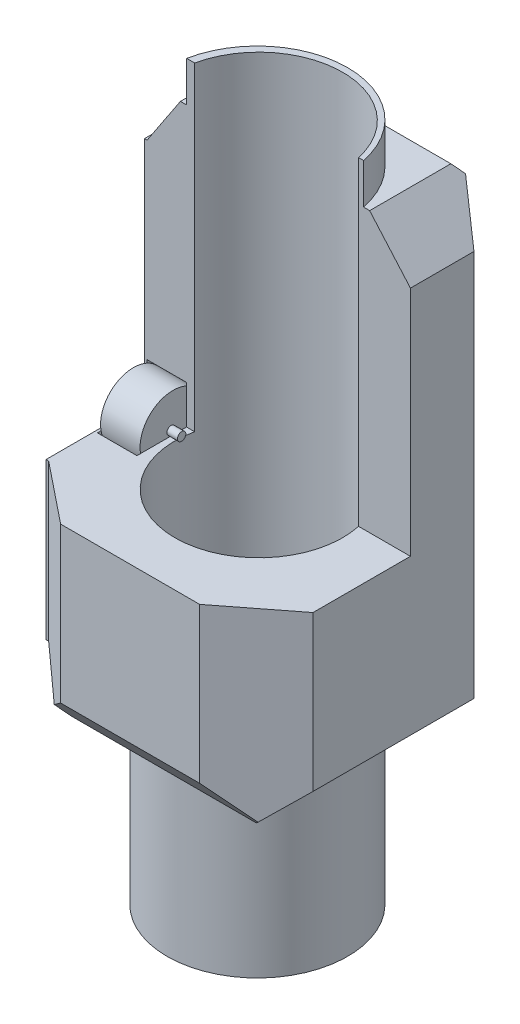
from build123d import *

# Parameters (mm, degrees)
SKETCH1_W           = 100
SKETCH1_H           = 100
BOSS_EXTRUDE1_DEPTH = 180
SKETCH2_R           = 34.257790197
BOSS_EXTRUDE2_DEPTH = 350
SKETCH3_W           = 152.006357392
SKETCH3_H           = 282.452416457
CUT_EXTRUDE2_DEPTH  = 400
CUT_EXTRUDE3_DEPTH  = 400
CUT_EXTRUDE4_DEPTH  = 400
CUT_EXTRUDE5_DEPTH  = 400
SKETCH7_W           = 160.159381639
SKETCH7_H           = 147.362276113
CUT_EXTRUDE6_DEPTH  = 400
SKETCH8_W           = 147.310744502
SKETCH8_H           = 162.038906966
CUT_EXTRUDE7_DEPTH  = 400
SKETCH9_R           = 31.847293423
CUT_EXTRUDE8_DEPTH  = 400
SKETCH10_W          = 140.220962397
SKETCH10_H          = 212.033531124
CUT_EXTRUDE9_DEPTH  = 400
SKETCH11_R          = 13.603137886
CUT_EXTRUDE11_DEPTH = 15
SKETCH12_R          = 12.495422516
BOSS_EXTRUDE3_DEPTH = 15
SKETCH13_R          = 1.594865099
BOSS_EXTRUDE4_DEPTH = 4
SKETCH14_W          = 100.74862993
SKETCH14_H          = 110.555003588
CUT_EXTRUDE13_DEPTH = 400
BOSS_EXTRUDE5_DEPTH = 1
SKETCH16_W          = 42.108585165
SKETCH16_H          = 30.458347221
BOSS_EXTRUDE6_DEPTH = 5
SKETCH17_W          = 18.669530869
SKETCH17_H          = 22.4027039
BOSS_EXTRUDE7_DEPTH = 1
SKETCH18_W          = 4.907623399
SKETCH18_H          = 5.170746831
SKETCH18_W_2        = 3.981473695
SKETCH18_H_2        = 5.451349552
BOSS_EXTRUDE8_DEPTH = 1
CUT_EXTRUDE14_DEPTH = 2


with BuildPart() as part:
    # Sketch1 → Boss-Extrude1 (new body)
    with BuildSketch(Plane(origin=(0, 0, 0), x_dir=(1, 0, 0), z_dir=(0, 1, 0))):
        with Locations((-50, 50)):
            Rectangle(SKETCH1_W, SKETCH1_H)
    extrude(amount=BOSS_EXTRUDE1_DEPTH)

    # Sketch2 → Boss-Extrude2 (add, symmetric)
    with BuildSketch(Plane(origin=(0, 180, 0), x_dir=(1, 0, 0), z_dir=(0, 1, 0))):
        with Locations(Location((-51.377291833, 49.076536384, 0), (0, 0, 270))):
            Circle(SKETCH2_R)
    extrude(amount=BOSS_EXTRUDE2_DEPTH, both=True)

    # Sketch3 → Cut-Extrude2 (cut)
    with BuildSketch(Plane(origin=(0, 0, 0), x_dir=(0, 0, -1), z_dir=(1, 0, 0))):
        with Locations((57.419900112, 502.274302507)):
            Rectangle(SKETCH3_W, SKETCH3_H)
    extrude(amount=-CUT_EXTRUDE2_DEPTH, mode=Mode.SUBTRACT)

    # Sketch4 → Cut-Extrude3 (cut)
    with BuildSketch(Plane(origin=(0, 0, 0), x_dir=(0, 0, -1), z_dir=(1, 0, 0))):
        Polygon((12.981970869, 0), (-8.994244796, 25.828096003), (-18.564506014, -15.259465835), align=None)
        Polygon((85.072517936, -1.448103984), (109.237639161, 19.113145112), (115.920034239, -3.267382694), align=None)
        Polygon((12.981970869, 180), (-8.994244796, 148.537596011), (-15.418178585, 193.219274892), align=None)
        Polygon((85.072517936, 181.854312784), (103.841225373, 159.795920888), (106.132549481, 198.647393934), align=None)
    extrude(amount=-CUT_EXTRUDE3_DEPTH, mode=Mode.SUBTRACT)

    # Sketch5 → Cut-Extrude4 (cut)
    with BuildSketch(Plane.XY):
        Polygon((-85.623287335, 0), (-106.370377984, 21.426392531), (-122.288861874, 3.209259887), (-93.526345261, -19.884701759), align=None)
        Polygon((-15.694988751, 0), (0, 15.257385304), (12.122677088, 15.257385304), (10.563067769, -19.884701759), align=None)
        Polygon((-87.166490339, 180.248071029), (-106.370377984, 151.29108453), (-117.705469457, 200.501115102), align=None)
        Polygon((-15.694988751, 180.248071029), (7.833767065, 153.279557508), (0, 193.941208308), align=None)
    extrude(amount=-CUT_EXTRUDE4_DEPTH, mode=Mode.SUBTRACT)

    # Sketch6 → Cut-Extrude5 (cut)
    with BuildSketch(Plane(origin=(0, 180, 0), x_dir=(1, 0, 0), z_dir=(0, 1, 0))):
        Polygon((-112.386997555, 28.400400964), (-64.261264503, -10.212759359), (-84.406366528, -15.51192827), (-124.649689542, -15.51192827), align=None)
        Polygon((-97.065537028, 135.861756084), (-119.37552445, 77.792688888), (-118.043343626, 64.347606737), (-66.428694172, 110.575168787), align=None)
        Polygon((-24.69640689, -21.815840769), (11.092108798, -8.97361337), (17.428316417, 32.393768119), (-38.531576846, -11.139157378), align=None)
        Polygon((-17.445484601, 140.804394854), (35.417473102, 107.262520599), (9.305452855, 72.996438725), (-31.724385352, 103.625272537), align=None)
    extrude(amount=-CUT_EXTRUDE5_DEPTH, mode=Mode.SUBTRACT)

    # Sketch7 → Cut-Extrude6 (cut)
    with BuildSketch(Plane.XY):
        with Locations((-66.123258915, -136.36252694)):
            Rectangle(SKETCH7_W, SKETCH7_H)
    extrude(amount=-CUT_EXTRUDE6_DEPTH, mode=Mode.SUBTRACT)

    # Sketch8 → Cut-Extrude7 (cut)
    with BuildSketch(Plane.XY):
        with Locations((-53.541153336, 332.448287589)):
            Rectangle(SKETCH8_W, SKETCH8_H)
    extrude(amount=-CUT_EXTRUDE7_DEPTH, mode=Mode.SUBTRACT)

    # Sketch9 → Cut-Extrude8 (cut)
    with BuildSketch(Plane(origin=(0, 251.428834106, 0), x_dir=(1, 0, 0), z_dir=(0, 1, 0))):
        with Locations(Location((-50.808993157, 49.032036374, 0), (0, 0, 270))):
            Circle(SKETCH9_R)
    extrude(amount=-CUT_EXTRUDE8_DEPTH, mode=Mode.SUBTRACT)

    # Sketch10 → Cut-Extrude9 (cut)
    with BuildSketch(Plane.ZY.offset(100)):
        with Locations((14.299084536, 180.100625535)):
            Rectangle(SKETCH10_W, SKETCH10_H)
    extrude(amount=-CUT_EXTRUDE9_DEPTH, mode=Mode.SUBTRACT)

    # Sketch11 → Cut-Extrude11 (cut)
    with BuildSketch(Plane.ZY.offset(100)):
        with Locations((-50.413251954, 76.264646142)):
            Circle(SKETCH11_R)
    extrude(amount=-CUT_EXTRUDE11_DEPTH, mode=Mode.SUBTRACT)

    # Sketch12 → Boss-Extrude3 (add)
    with BuildSketch(Plane.ZY.offset(85)):
        with Locations(Location((-50.658800768, 76.222522328, 0), (0, 0, 114.353089558))):
            Circle(SKETCH12_R)
    extrude(amount=BOSS_EXTRUDE3_DEPTH)

    # Sketch13 → Boss-Extrude4 (add)
    with BuildSketch(Plane(origin=(-85, 0, 0), x_dir=(0, 0, -1), z_dir=(1, 0, 0))):
        with Locations(Location((49.945205578, 75.944780088, 0), (0, 0, 180))):
            Circle(SKETCH13_R)
    extrude(amount=BOSS_EXTRUDE4_DEPTH)

    # Sketch14 → Cut-Extrude13 (cut)
    with BuildSketch(Plane.ZY.offset(100)):
        with Locations((-65.350029467, 250.603414818)):
            Rectangle(SKETCH14_W, SKETCH14_H)
    extrude(amount=-CUT_EXTRUDE13_DEPTH, mode=Mode.SUBTRACT)

    # Sketch15 → Boss-Extrude5 (add)
    with BuildSketch(Plane.ZY.offset(100)):
        Polygon((-18.461827727, 14.847435435), (-80.507743362, 14.847435435), (-80.507743362, 160.896793159), (-55.811396663, 160.896793159), (-55.811396663, 74.083859973), (-18.461827727, 74.083859973), align=None)
    extrude(amount=BOSS_EXTRUDE5_DEPTH)

    # Sketch16 → Boss-Extrude6 (add)
    with BuildSketch(Plane.ZY.offset(101)):
        with Locations((-48.07732297, 45.136437142)):
            Rectangle(SKETCH16_W, SKETCH16_H)
    extrude(amount=BOSS_EXTRUDE6_DEPTH)

    # Sketch17 → Boss-Extrude7 (add)
    with BuildSketch(Plane.ZY.offset(101)):
        with Locations((-67.04663872, 130.409241603)):
            Rectangle(SKETCH17_W, SKETCH17_H)
    extrude(amount=BOSS_EXTRUDE7_DEPTH)

    # Sketch18 → Boss-Extrude8 (add)
    with BuildSketch(Plane.ZY.offset(102)):
        with Locations((-71.625108618, 130.213401885)):
            Rectangle(SKETCH18_W, SKETCH18_H)
        with Locations((-62.297675883, 129.867186512)):
            Rectangle(SKETCH18_W_2, SKETCH18_H_2)
    extrude(amount=BOSS_EXTRUDE8_DEPTH)

    # Sketch19 → Cut-Extrude14 (cut)
    with BuildSketch(Plane.ZY.offset(102)):
        Polygon((-66.976455081, 134.868836652), (-73.7929295, 134.868836652), (-73.7929295, 134.108269479), (-74.571872104, 134.108269479), (-74.571872104, 140.512729543), (-73.7929295, 140.512729543), (-72.165965418, 140.512729543), (-72.233411796, 137.421948277), (-71.48458153, 137.421948277), (-71.410861795, 140.512729543), (-69.158339735, 140.504865112), (-69.158339735, 137.421948277), (-68.22174926, 137.421948277), (-68.22174926, 140.567922793), (-65.426885805, 140.567922793), (-65.515241968, 137.446210948), (-64.714122339, 137.446210948), (-64.714122339, 140.567922793), (-62.410871788, 140.567922793), (-62.410871788, 137.210126003), (-61.403493639, 137.210126003), (-61.403493639, 140.631129361), (-58.889974549, 140.631129361), (-58.889974549, 136.595539338), (-59.698319644, 136.595539338), (-59.698319644, 139.99489006), (-60.695848378, 139.984078324), (-60.695848378, 136.667717235), (-63.090112056, 136.667717235), (-63.090112056, 139.979723883), (-64.00479018, 139.979723883), (-64.00479018, 136.667717235), (-66.334605538, 136.667717235), (-66.334605538, 139.902697072), (-67.48995239, 139.902697072), (-67.48995239, 136.667717235), (-70.008746759, 136.667717235), (-70.008746759, 139.902697072), (-70.709698815, 139.902697072), (-70.783897489, 136.693128041), (-72.921241048, 136.693128041), (-72.921241048, 139.545601992), (-73.7929295, 139.545601992), (-73.7929295, 135.423339258), (-66.976455081, 135.49721976), align=None)
    extrude(amount=-CUT_EXTRUDE14_DEPTH, mode=Mode.SUBTRACT)


solid = part.part
